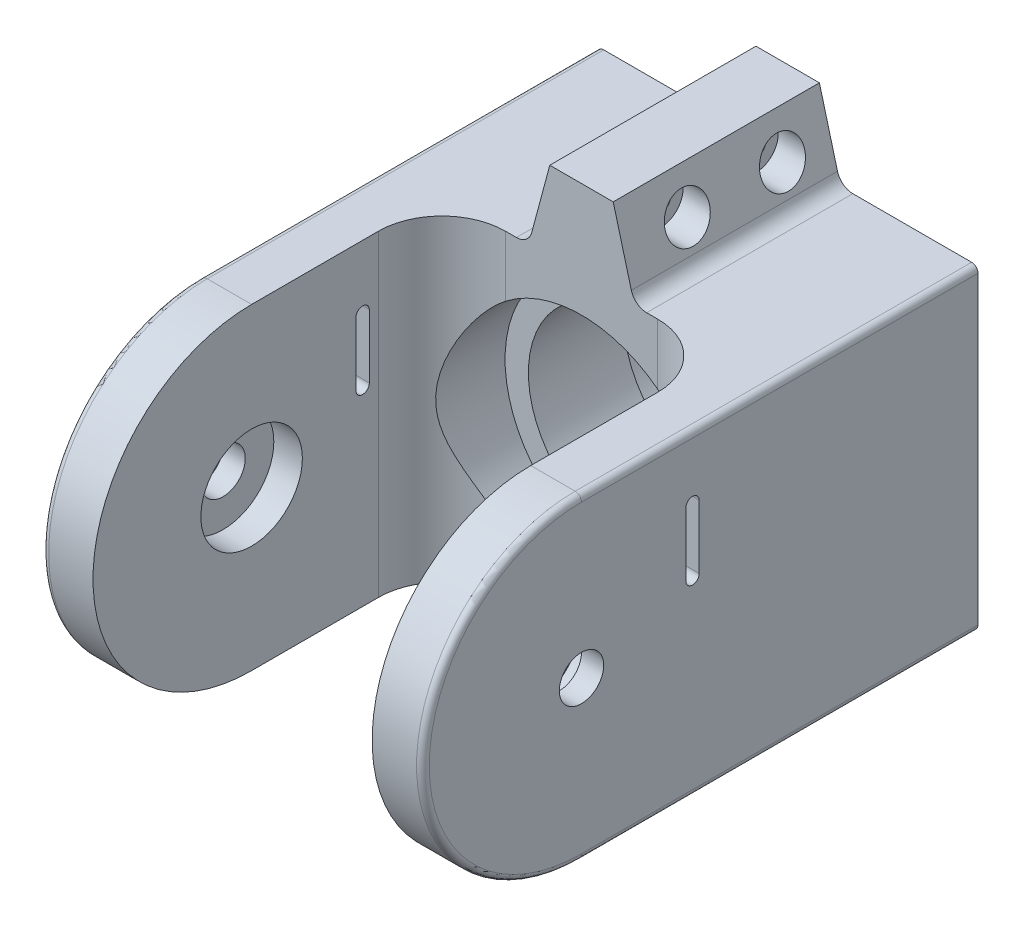
from build123d import *

# Parameters (mm, degrees)
SKETCH1_R                 = 39.1
SKETCH1_R_2               = 31.75
CENTRE_HOLE_FOR_L2_DEPTH  = 30
MAIN_STRUCTURE_DEPTH      = 75
MAIN_STRUCTURE_DEPTH_BACK = 50
SKETCH2_W                 = 120
SKETCH2_H                 = 100
SKETCH2_R                 = 39.1
BEARING_CURVE_DEPTH       = 16
SHAFT_START               = -16
SKETCH6_R                 = 7
SHAFT_HOLE_DEPTH          = 16
WRIST_CUTOUT_DEPTH        = 194.971647413
SKETCH9_R                 = 16
BEARING_DEPTH             = 9
BOLT_STRUCTURE_DEPTH      = 65
SKETCH11_R                = 3.1
CUT_EXTRUDE6_DEPTH        = 183.345825288
CUT_EXTRUDE8_REACH        = 189.346
CUT_EXTRUDE8_START        = 5
SKETCH13_R                = 7
FILLET3_R                 = 5
FILLET1_R                 = 2
TENSIONER_SLOT_DEPTH      = 104


with BuildPart() as part:
    # Sketch1 → Centre Hole for L2 (new body)
    with BuildSketch(Plane.XY):
        Circle(SKETCH1_R)
        Circle(SKETCH1_R_2, mode=Mode.SUBTRACT)
    extrude(amount=CENTRE_HOLE_FOR_L2_DEPTH)


with BuildPart() as body_2:
    # Sketch2 → Main Structure (new, two sides: drawn at the far end of the back side and taken through both)
    with BuildSketch(Plane.XY.offset(30).offset(-MAIN_STRUCTURE_DEPTH_BACK)):
        Rectangle(SKETCH2_W, SKETCH2_H)
        Circle(SKETCH2_R, mode=Mode.SUBTRACT)
    extrude(amount=MAIN_STRUCTURE_DEPTH + MAIN_STRUCTURE_DEPTH_BACK)

    # Sketch3 → Bearing Curve (add)
    with BuildSketch(Plane.ZY.offset(60)):
        with BuildLine():
            Line((105, 50), (105, -50))
            ThreePointArc((105, -50), (155, 0), (105, 50))
        make_face()
    bearing_curve = extrude(amount=-BEARING_CURVE_DEPTH)

    # Upright Mirror: Bearing Curve across plane
    add(bearing_curve.mirror(Plane(origin=(0, 0, 0), x_dir=(0, 0, 1), z_dir=(1, 0, 0))))

    # Sketch6 → Shaft Hole (cut)
    with BuildSketch(Plane.ZY.offset(60).offset(SHAFT_START)):
        with Locations((105, 0)):
            Circle(SKETCH6_R)
    shaft_hole = extrude(amount=SHAFT_HOLE_DEPTH, mode=Mode.SUBTRACT)

    # Sketch4 → Wrist Cutout (cut, through all)
    with BuildSketch(Plane(origin=(0, 50, 0), x_dir=(1, 0, 0), z_dir=(0, 1, 0))):
        with BuildLine():
            Line((-44, -105), (-44, -65))
            ThreePointArc((-44, -65), (-38.142135624, -50.857864376), (-24, -45))
            Line((-24, -45), (24, -45))
            ThreePointArc((24, -45), (38.142135624, -50.857864376), (44, -65))
            Line((44, -65), (44, -105))
            Line((44, -105), (-44, -105))
        make_face()
    extrude(amount=-WRIST_CUTOUT_DEPTH, mode=Mode.SUBTRACT)

    # Sketch9 → Bearing (cut)
    with BuildSketch(Plane(origin=(-44, 0, 0), x_dir=(0, 0, -1), z_dir=(1, 0, 0))):
        with Locations((-105, 0)):
            Circle(SKETCH9_R)
    bearing = extrude(amount=-BEARING_DEPTH, mode=Mode.SUBTRACT)

    # Bearing Mirror: Shaft Hole, Bearing across plane
    add(shaft_hole.mirror(Plane(origin=(0, 0, 0), x_dir=(0, 0, 1), z_dir=(1, 0, 0))), mode=Mode.SUBTRACT)
    add(bearing.mirror(Plane(origin=(0, 0, 0), x_dir=(0, 0, 1), z_dir=(1, 0, 0))), mode=Mode.SUBTRACT)

    # Sketch10 → Bolt Structure (add)
    with BuildSketch(Plane(origin=(0, 0, -20), x_dir=(-1, 0, 0), z_dir=(0, 0, -1))):
        Polygon((10, 75), (-10, 75), (-16.698729811, 50), (16.698729811, 50), align=None)
    bolt_structure = extrude(amount=-BOLT_STRUCTURE_DEPTH)

    # Sketch11 → Cut-Extrude6 (cut, symmetric)
    with BuildSketch(Plane(origin=(0, 0, 0), x_dir=(0, 0, -1), z_dir=(1, 0, 0))):
        with Locations(Location((5, 62.5, 0), (0, 0, 90))):
            Circle(SKETCH11_R)
        with Locations(Location((-25, 62.5, 0), (0, 0, 90))):
            Circle(SKETCH11_R)
    cut_extrude6 = extrude(amount=CUT_EXTRUDE6_DEPTH, both=True, mode=Mode.SUBTRACT)

    # Cut-Extrude8: up to this plane
    cut_extrude8_end = Plane(origin=(10, 75, 86.71798544), z_dir=(0.9659258262890692, 0.25881904510251774, 0))
    # Sketch13 → Cut-Extrude8 (cut, up to the surface)
    with BuildSketch(Plane(origin=(0, 0, 0), x_dir=(0, 0, -1), z_dir=(1, 0, 0)).offset(CUT_EXTRUDE8_START), mode=Mode.PRIVATE) as cut_extrude8_sk1:
        with Locations(Location((5, 62.5, 0), (0, 0, 90))):
            Circle(SKETCH13_R)
    cut_extrude8_tool1 = split(extrude(cut_extrude8_sk1.sketch, amount=CUT_EXTRUDE8_REACH, mode=Mode.PRIVATE), bisect_by=cut_extrude8_end, keep=Keep.BOTH, mode=Mode.PRIVATE)
    # Sketch13 → Cut-Extrude8 (cut, up to the surface)
    with BuildSketch(Plane(origin=(0, 0, 0), x_dir=(0, 0, -1), z_dir=(1, 0, 0)).offset(CUT_EXTRUDE8_START), mode=Mode.PRIVATE) as cut_extrude8_sk2:
        with Locations(Location((-25, 62.5, 0), (0, 0, 90))):
            Circle(SKETCH13_R)
    cut_extrude8_tool2 = split(extrude(cut_extrude8_sk2.sketch, amount=CUT_EXTRUDE8_REACH, mode=Mode.PRIVATE), bisect_by=cut_extrude8_end, keep=Keep.BOTH, mode=Mode.PRIVATE)
    cut_extrude8 = cut_extrude8_tool1.solids().sort_by_distance((5, 62.5, -5))[0] + cut_extrude8_tool2.solids().sort_by_distance((5, 62.5, 25))[0]
    add(cut_extrude8, mode=Mode.SUBTRACT)

    # Mirror8: Bolt Structure, Cut-Extrude6, Cut-Extrude8 across plane
    add(bolt_structure.mirror(Plane.ZX))
    add(cut_extrude6.mirror(Plane.ZX), mode=Mode.SUBTRACT)
    add(cut_extrude8.mirror(Plane.ZX), mode=Mode.SUBTRACT)

    # Fillet3
    fillet3_edges = [body_2.edges().sort_by_distance(p)[0] for p in [
        (-16.698729811, 50, 12.5),
        (16.698729811, 50, 12.5),
        (16.698729811, -50, 12.5),
        (-16.698729811, -50, 12.5),
    ]]
    fillet(fillet3_edges, radius=FILLET3_R)

    # Fillet1
    fillet1_edges = [body_2.edges().sort_by_distance(p)[0] for p in [
        (-60, 50, 42.5),
        (60, 50, 42.5),
        (60, -50, 42.5),
        (-60, -50, 42.5),
        (-60, 0, 155),
        (60, 0, 155),
    ]]
    fillet(fillet1_edges, radius=FILLET1_R)

    # Sketch14 → Tensioner Slot (cut)
    with BuildSketch(Plane.ZY.offset(60)):
        with BuildLine():
            Line((72.1, 30), (72.1, 10))
            ThreePointArc((72.1, 10), (70, 7.9), (67.9, 10))
            Line((67.9, 10), (67.9, 30))
            ThreePointArc((67.9, 30), (70, 32.1), (72.1, 30))
        make_face()
    tensioner_slot = extrude(amount=-TENSIONER_SLOT_DEPTH, mode=Mode.SUBTRACT)

    # Mirror9: Tensioner Slot across plane
    add(tensioner_slot.mirror(Plane(origin=(0, 0, 0), x_dir=(0, 0, 1), z_dir=(1, 0, 0))), mode=Mode.SUBTRACT)


solid = Compound([part.part, body_2.part])
